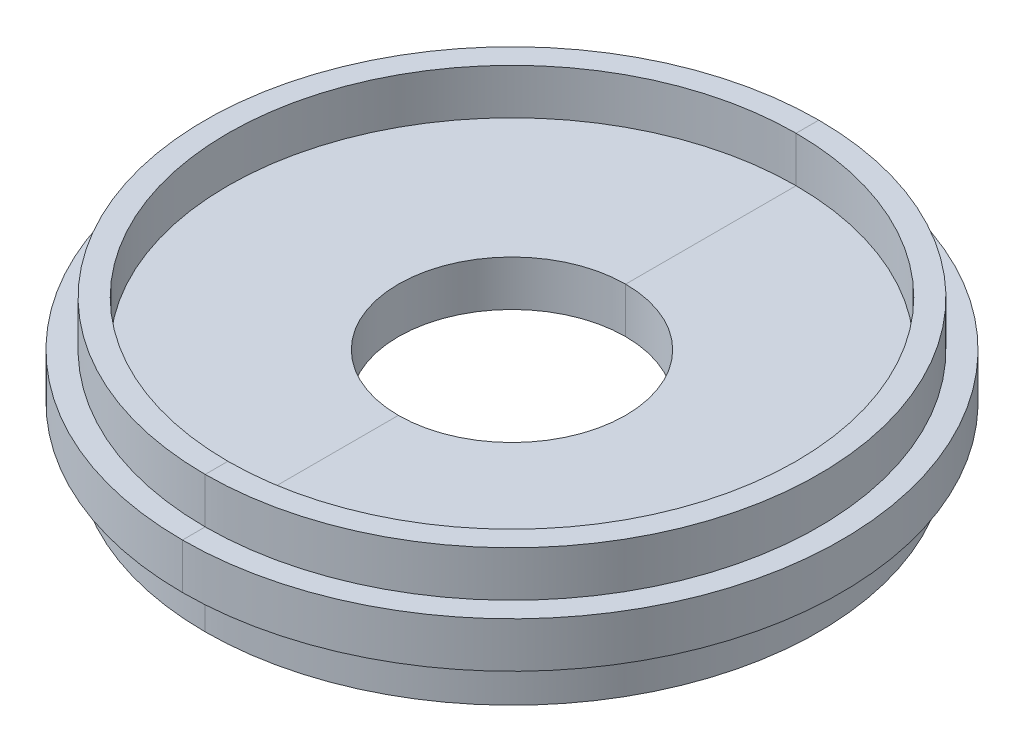
from build123d import *

# Parameters (mm, degrees)
SKETCH1_R            = 92.075
SKETCH1_R_2          = 31.75
BOSS_EXTRUDE1_DEPTH  = 6.35
SKETCH5_R            = 85.725
SKETCH5_R_2          = 79.375
BOSS_EXTRUDE2_DEPTH  = 12.7
BOSS_EXTRUDE3_DEPTH  = 25.4
MIRROR5_COPY_1_DEPTH = 25.4
MIRROR5_COPY_2_DEPTH = 25.4


with BuildPart() as part:
    # Sketch1 → Boss-Extrude1 (new, symmetric)
    with BuildSketch(Plane(origin=(0, 0, 0), x_dir=(1, 0, 0), z_dir=(0, 1, 0))):
        with Locations(Location((0, 0, 0), (0, 0, 270))):
            Circle(SKETCH1_R)
        with Locations(Location((0, 0, 0), (0, 0, 270))):
            Circle(SKETCH1_R_2, mode=Mode.SUBTRACT)
    extrude(amount=BOSS_EXTRUDE1_DEPTH, both=True)

    # Sketch5 → Boss-Extrude2 (add)
    with BuildSketch(Plane(origin=(0, 6.35, 0), x_dir=(1, 0, 0), z_dir=(0, 1, 0))):
        with Locations(Location((0, 0, 0), (0, 0, 270))):
            Circle(SKETCH5_R)
        with Locations(Location((0, 0, 0), (0, 0, 270))):
            Circle(SKETCH5_R_2, mode=Mode.SUBTRACT)
    boss_extrude2 = extrude(amount=BOSS_EXTRUDE2_DEPTH)

    # Mirror1: Boss-Extrude2 across plane
    add(boss_extrude2.mirror(Plane.ZX))

    # Sketch7 → Boss-Extrude3 (add)
    with BuildSketch(Plane(origin=(0, 19.05, 0), x_dir=(1, 0, 0), z_dir=(0, 1, 0))):
        with BuildLine():
            Line((-25.787822327, 75.06916041), (-28.166257291, 80.965656764))
            ThreePointArc((-28.166257291, 80.965656764), (0, 85.725), (28.166257291, 80.965656764))
            Line((28.166257291, 80.965656764), (25.787822327, 75.06916041))
            ThreePointArc((25.787822327, 75.06916041), (0, 79.375), (-25.787822327, 75.06916041))
        make_face()
    boss_extrude3 = extrude(amount=-BOSS_EXTRUDE3_DEPTH)

    # Mirror3: Boss-Extrude3 across plane
    add(boss_extrude3.mirror(Plane.ZX))

    # Mirror4: Boss-Extrude3 across plane
    add(boss_extrude3.mirror(Plane.XY))

    # Mirror5 copy 1 sketch → Mirror5 copy 1 (add)
    with BuildSketch(Plane.XZ.offset(19.05)):
        with BuildLine():
            Line((-25.787822327, 75.06916041), (-28.166257291, 80.965656764))
            ThreePointArc((-28.166257291, 80.965656764), (0, 85.725), (28.166257291, 80.965656764))
            Line((28.166257291, 80.965656764), (25.787822327, 75.06916041))
            ThreePointArc((25.787822327, 75.06916041), (0, 79.375), (-25.787822327, 75.06916041))
        make_face()
    extrude(amount=-MIRROR5_COPY_1_DEPTH)

    # Mirror5 copy 2 sketch → Mirror5 copy 2 (add)
    with BuildSketch(Plane.XZ.offset(19.05)):
        with BuildLine():
            Line((-25.787822327, -75.06916041), (-28.166257291, -80.965656764))
            ThreePointArc((-28.166257291, -80.965656764), (0, -85.725), (28.166257291, -80.965656764))
            Line((28.166257291, -80.965656764), (25.787822327, -75.06916041))
            ThreePointArc((25.787822327, -75.06916041), (0, -79.375), (-25.787822327, -75.06916041))
        make_face()
    extrude(amount=-MIRROR5_COPY_2_DEPTH)


with BuildPart() as body_2:
    # Split1: the piece on the far side of the plane
    add(part.part)
    split(bisect_by=Plane(origin=(0, 0, 0), x_dir=(0, 0, 1), z_dir=(1, 0, 0)), keep=Keep.BOTTOM)


with BuildPart() as part_1:
    add(part.part)

    # Split1
    split(bisect_by=Plane(origin=(0, 0, 0), x_dir=(0, 0, 1), z_dir=(1, 0, 0)), keep=Keep.TOP)


solid = Compound([body_2.part, part_1.part])
